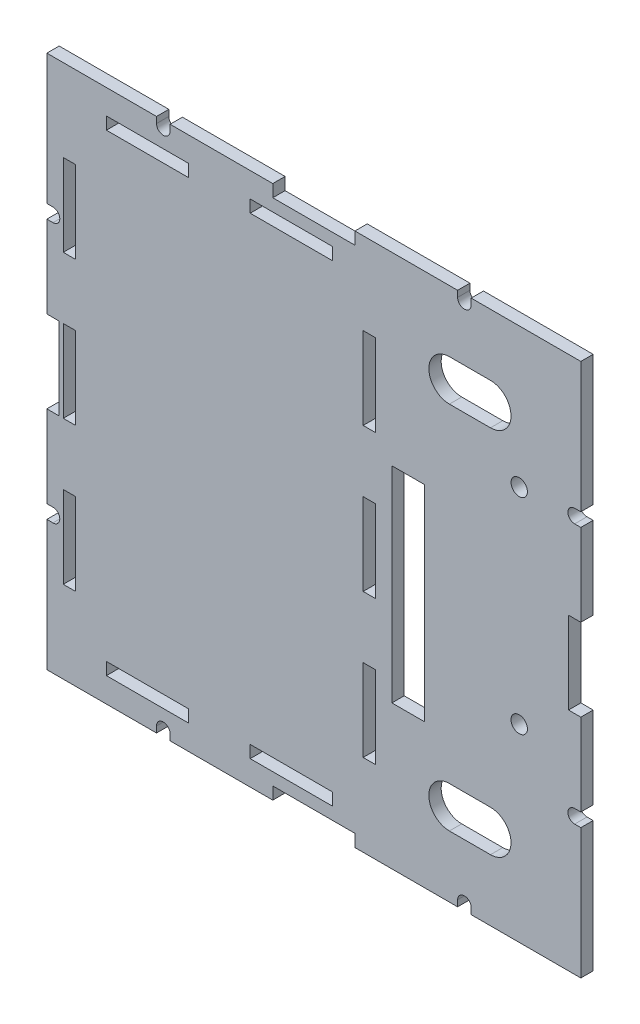
from build123d import *

# Parameters (mm, degrees)
SKETCH1_W           = 20
SKETCH1_H           = 3
SKETCH1_W_2         = 3
SKETCH1_H_2         = 20
SKETCH1_W_3         = 8
SKETCH1_H_3         = 50
SKETCH1_R           = 2
BOSS_EXTRUDE1_DEPTH = 3


with BuildPart() as part:
    # Sketch1 → Boss-Extrude1 (new body)
    with BuildSketch(Plane.XY):
        with BuildLine():
            Line((10, -62), (10, -65))
            Line((10, -65), (35, -65))
            Line((35, -65), (35, -63.5))
            ThreePointArc((35, -63.5), (36.65, -61.85), (38.3, -63.5))
            Line((38.3, -63.5), (38.3, -65))
            Line((38.3, -65), (65, -65))
            Line((65, -65), (65, -33.3))
            Line((65, -33.3), (63.5, -33.3))
            ThreePointArc((63.5, -33.3), (61.85, -31.65), (63.5, -30))
            Line((63.5, -30), (65, -30))
            Line((65, -30), (65, -10))
            Line((65, -10), (62, -10))
            Line((62, -10), (62, 10))
            Line((62, 10), (65, 10))
            Line((65, 10), (65, 30))
            Line((65, 30), (63.5, 30))
            ThreePointArc((63.5, 30), (61.85, 31.65), (63.5, 33.3))
            Line((63.5, 33.3), (65, 33.3))
            Line((65, 33.3), (65, 65))
            Line((65, 65), (38.3, 65))
            Line((38.3, 65), (38.3, 63.5))
            ThreePointArc((38.3, 63.5), (36.65, 61.85), (35, 63.5))
            Line((35, 63.5), (35, 65))
            Line((35, 65), (10, 65))
            Line((10, 65), (10, 62))
            Line((10, 62), (-10, 62))
            Line((-10, 62), (-10, 65))
            Line((-10, 65), (-35, 65))
            Line((-35, 65), (-35, 63.5))
            ThreePointArc((-35, 63.5), (-36.65, 61.85), (-38.3, 63.5))
            Line((-38.3, 63.5), (-38.3, 65))
            Line((-38.3, 65), (-65, 65))
            Line((-65, 65), (-65, 33.3))
            Line((-65, 33.3), (-63.5, 33.3))
            ThreePointArc((-63.5, 33.3), (-61.85, 31.65), (-63.5, 30))
            Line((-63.5, 30), (-65, 30))
            Line((-65, 30), (-65, 10))
            Line((-65, 10), (-62, 10))
            Line((-62, 10), (-62, -10))
            Line((-62, -10), (-65, -10))
            Line((-65, -10), (-65, -30))
            Line((-65, -30), (-63.5, -30))
            ThreePointArc((-63.5, -30), (-61.85, -31.65), (-63.5, -33.3))
            Line((-63.5, -33.3), (-65, -33.3))
            Line((-65, -33.3), (-65, -65))
            Line((-65, -65), (-38.3, -65))
            Line((-38.3, -65), (-38.3, -63.5))
            ThreePointArc((-38.3, -63.5), (-36.65, -61.85), (-35, -63.5))
            Line((-35, -63.5), (-35, -65))
            Line((-35, -65), (-10, -65))
            Line((-10, -65), (-10, -62))
            Line((-10, -62), (10, -62))
        make_face()
        with Locations((-40.5, -57.5)):
            Rectangle(SKETCH1_W, SKETCH1_H, mode=Mode.SUBTRACT)
        with Locations((-59.5, -35)):
            Rectangle(SKETCH1_W_2, SKETCH1_H_2, mode=Mode.SUBTRACT)
        with Locations((-5.5, -57.5)):
            Rectangle(SKETCH1_W, SKETCH1_H, mode=Mode.SUBTRACT)
        with Locations((13.5, -35)):
            Rectangle(SKETCH1_W_2, SKETCH1_H_2, mode=Mode.SUBTRACT)
        with BuildLine():
            Line((33, -40), (43, -40))
            ThreePointArc((43, -40), (48, -45), (43, -50))
            Line((43, -50), (33, -50))
            ThreePointArc((33, -50), (28, -45), (33, -40))
        make_face(mode=Mode.SUBTRACT)
        with Locations((23, -5)):
            Rectangle(SKETCH1_W_3, SKETCH1_H_3, mode=Mode.SUBTRACT)
        with Locations((50, -19)):
            Circle(SKETCH1_R, mode=Mode.SUBTRACT)
        with Locations((-59.5, 0)):
            Rectangle(SKETCH1_W_2, SKETCH1_H_2, mode=Mode.SUBTRACT)
        with Locations((-59.5, 35)):
            Rectangle(SKETCH1_W_2, SKETCH1_H_2, mode=Mode.SUBTRACT)
        with Locations((-40.5, 57.5)):
            Rectangle(SKETCH1_W, SKETCH1_H, mode=Mode.SUBTRACT)
        with Locations((-5.5, 57.5)):
            Rectangle(SKETCH1_W, SKETCH1_H, mode=Mode.SUBTRACT)
        with Locations((13.5, 0)):
            Rectangle(SKETCH1_W_2, SKETCH1_H_2, mode=Mode.SUBTRACT)
        with Locations((50, 31)):
            Circle(SKETCH1_R, mode=Mode.SUBTRACT)
        with Locations((13.5, 35)):
            Rectangle(SKETCH1_W_2, SKETCH1_H_2, mode=Mode.SUBTRACT)
        with BuildLine():
            ThreePointArc((43, 50), (48, 45), (43, 40))
            Line((43, 40), (33, 40))
            ThreePointArc((33, 40), (28, 45), (33, 50))
            Line((33, 50), (43, 50))
        make_face(mode=Mode.SUBTRACT)
    extrude(amount=BOSS_EXTRUDE1_DEPTH)


solid = part.part
